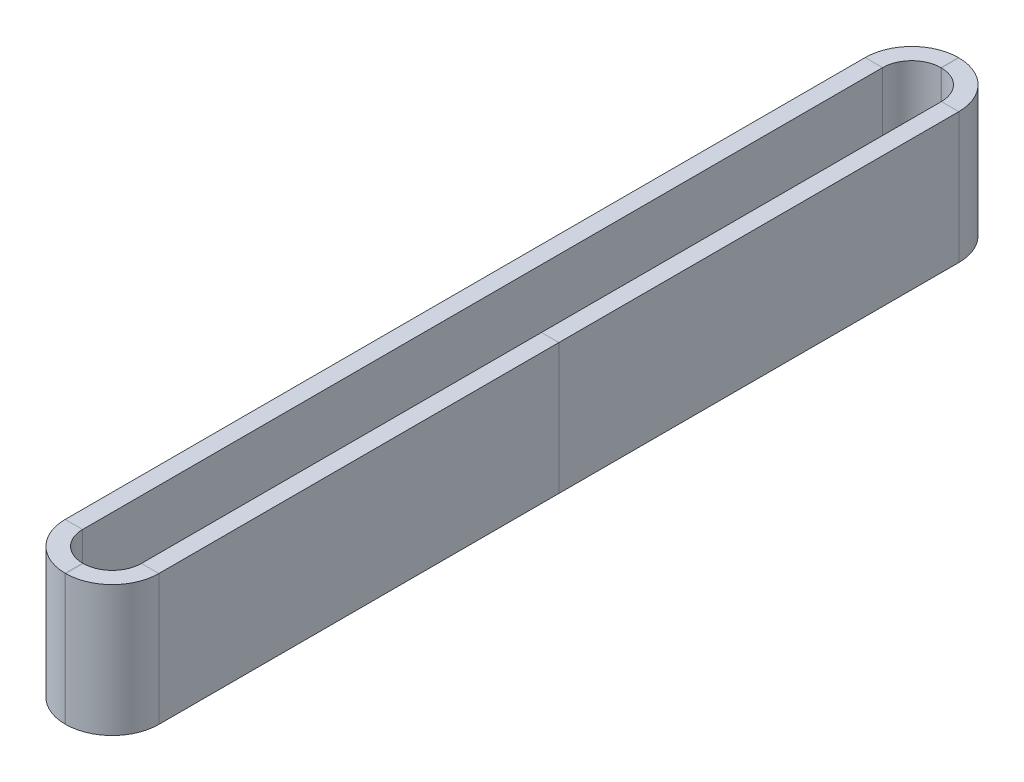
from build123d import *

# Parameters (mm, degrees)
SKETCH3_W = 4
SKETCH3_H = 30


with BuildPart() as part:
    # Sweep1: sweep along a path in Sketch1
    with BuildLine(Plane(origin=(0, 0, 0), x_dir=(1, 0, 0), z_dir=(0, 1, 0))) as sweep1_path:
        Line((-0.05, 100.5), (0.05, 100.5))
        ThreePointArc((0.05, 100.5), (6.201828996, 97.951828996), (8.75, 91.8))
        Line((8.75, 91.8), (8.75, -91.8))
        ThreePointArc((8.75, -91.8), (6.201828996, -97.951828996), (0.05, -100.5))
        Line((0.05, -100.5), (-0.05, -100.5))
        ThreePointArc((-0.05, -100.5), (-6.201828996, -97.951828996), (-8.75, -91.8))
        Line((-8.75, -91.8), (-8.75, 91.8))
        ThreePointArc((-8.75, 91.8), (-6.201828996, 97.951828996), (-0.05, 100.5))
    # Sketch3 → Sweep1 (sweep)
    with BuildSketch(Plane.XY):
        with Locations((8.75, 0)):
            Rectangle(SKETCH3_W, SKETCH3_H)
    sweep(path=sweep1_path.line)


solid = part.part
